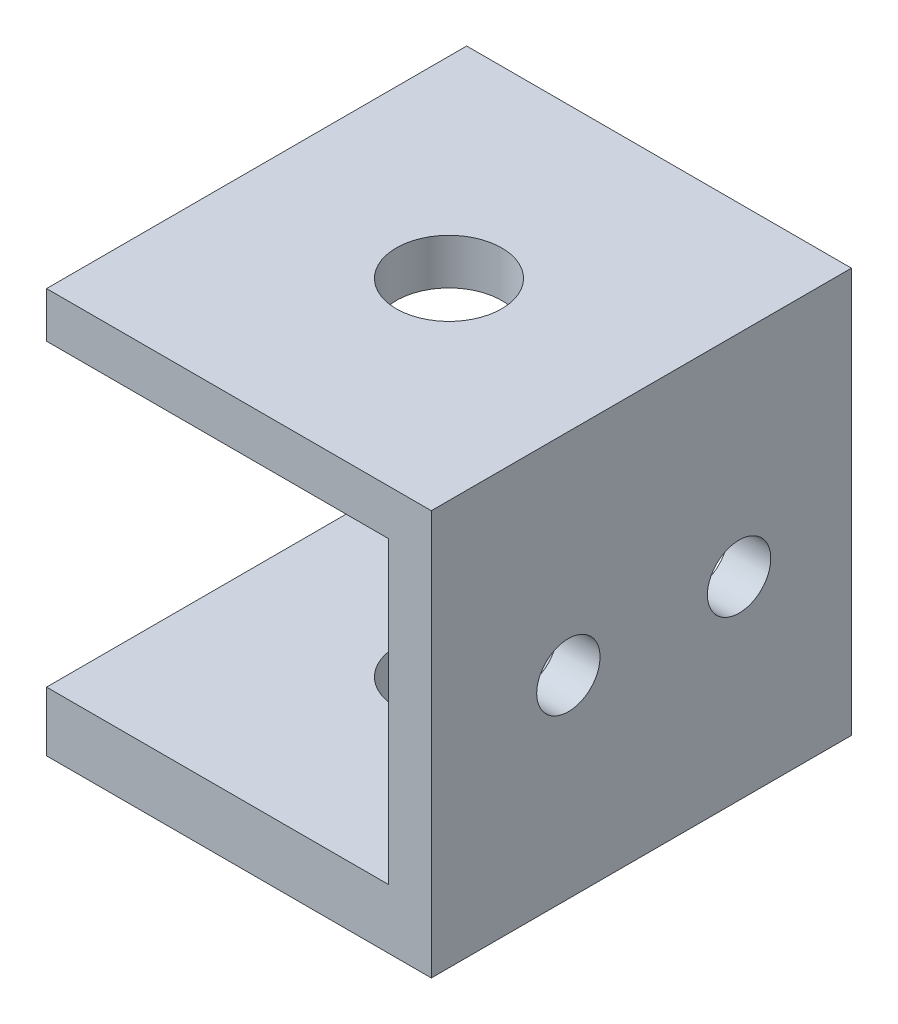
from build123d import *

# Parameters (mm, degrees)
ESQUISSE1_W             = 45.791168344
ESQUISSE1_H             = 48.162822482
BOSS_EXTRU_1_DEPTH      = 50
ESQUISSE6_W             = 40.720467392
ESQUISSE6_H             = 35.64976644
ENL_V_MAT_EXTRU_2_DEPTH = 84.165428922
ESQUISSE7_R             = 6.277140529
ENL_V_MAT_EXTRU_3_DEPTH = 84.165428922
ESQUISSE8_R             = 3.769419749
ENL_V_MAT_EXTRU_4_DEPTH = 81.484867733


with BuildPart() as part:
    # Esquisse1 → Boss.-Extru.1 (new body)
    with BuildSketch(Plane.XY):
        with Locations((22.895584172, 24.081411241)):
            Rectangle(ESQUISSE1_W, ESQUISSE1_H)
    extrude(amount=BOSS_EXTRU_1_DEPTH)

    # Esquisse6 → Enlèv. mat.-Extru.2 (cut, through all)
    with BuildSketch(Plane.XY.offset(50)):
        with Locations((20.360233696, 24.911961355)):
            Rectangle(ESQUISSE6_W, ESQUISSE6_H)
    extrude(amount=-ENL_V_MAT_EXTRU_2_DEPTH, mode=Mode.SUBTRACT)

    # Esquisse7 → Enlèv. mat.-Extru.3 (cut, through all)
    with BuildSketch(Plane(origin=(0, 48.162822482, 0), x_dir=(1, 0, 0), z_dir=(0, 1, 0))):
        with Locations(Location((22.895584172, -25, 0), (0, 0, 270))):
            Circle(ESQUISSE7_R)
    extrude(amount=-ENL_V_MAT_EXTRU_3_DEPTH, mode=Mode.SUBTRACT)

    # Esquisse8 → Enlèv. mat.-Extru.4 (cut, through all)
    with BuildSketch(Plane.ZY.offset(-40.720467392)):
        with Locations((13.372298401, 23.059195716)):
            Circle(ESQUISSE8_R)
        with Locations((33.688831964, 23.059195716)):
            Circle(ESQUISSE8_R)
    extrude(amount=-ENL_V_MAT_EXTRU_4_DEPTH, mode=Mode.SUBTRACT)


solid = part.part
